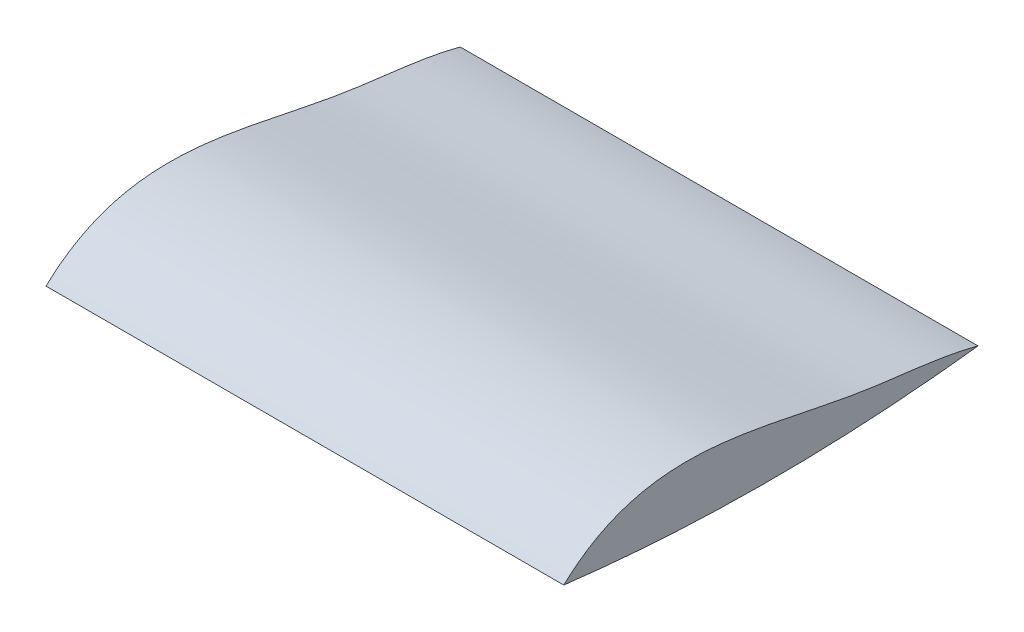
from build123d import *


with BuildPart() as part:
    # Sweep1: sweep along a path in Sketch2
    with BuildLine(Plane(origin=(0, 0, 0), x_dir=(1, 0, 0), z_dir=(0, 1, 0))) as sweep1_path:
        Line((0, 45.524264264), (-635, 45.524264264))
    # Sketch1 → Sweep1 (sweep)
    with BuildSketch(Plane(origin=(0, 0, 0), x_dir=(0, 0, -1), z_dir=(1, 0, 0))):
        with BuildLine():
            add(Edge.make_bspline(
                [(-43.700976459, -3.675096456), (60.093960524, 93.557671037), (246.664616316, 18.259692077), (417.699427231, 8.740783901), (464.299023541, -3.675096456)],
                knots=[0, 0, 0, 0, 0.726776815, 1, 1, 1, 1], degree=3))
            add(Edge.make_bspline(
                [(-43.700976459, -3.675096456), (209.422998909, -34.32642273), (464.299023541, -3.675096456)],
                knots=[0, 0, 0, 1, 1, 1], degree=2))
        make_face()
    sweep(path=sweep1_path.line)


solid = part.part
